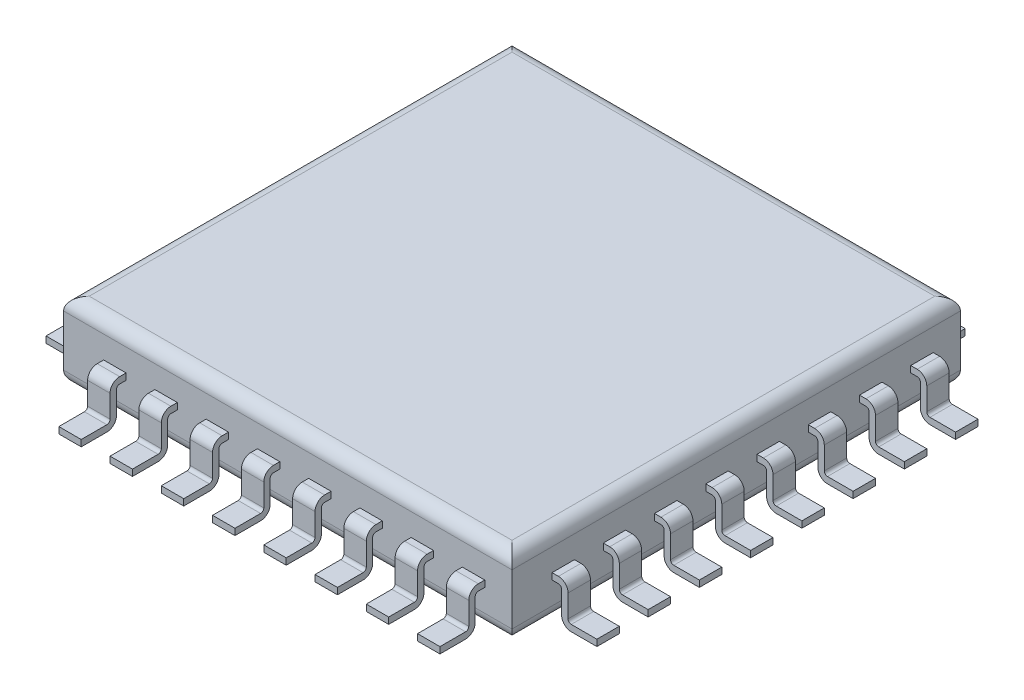
from build123d import *

# Parameters (mm, degrees)
SKETCH1_W                    = 7
SKETCH1_H                    = 7
BOSS_EXTRUDE1_DEPTH          = 1.2
FILLET1_R                    = 0.2
SKETCH3_W                    = 0.35
SKETCH3_H                    = 0.1
LPATTERN1_COUNT              = 8
LPATTERN1_PITCH              = 0.8
CIRPATTERN1_COPY_1_SKETCH_W  = 0.35
CIRPATTERN1_COPY_1_SKETCH_H  = 0.1
CIRPATTERN1_COPY_2_SKETCH_W  = 0.35
CIRPATTERN1_COPY_2_SKETCH_H  = 0.1
CIRPATTERN1_COPY_3_SKETCH_W  = 0.35
CIRPATTERN1_COPY_3_SKETCH_H  = 0.1
CIRPATTERN1_COPY_4_SKETCH_W  = 0.35
CIRPATTERN1_COPY_4_SKETCH_H  = 0.1
CIRPATTERN1_COPY_5_SKETCH_W  = 0.35
CIRPATTERN1_COPY_5_SKETCH_H  = 0.1
CIRPATTERN1_COPY_6_SKETCH_W  = 0.35
CIRPATTERN1_COPY_6_SKETCH_H  = 0.1
CIRPATTERN1_COPY_7_SKETCH_W  = 0.35
CIRPATTERN1_COPY_7_SKETCH_H  = 0.1
CIRPATTERN1_COPY_8_SKETCH_W  = 0.35
CIRPATTERN1_COPY_8_SKETCH_H  = 0.1
CIRPATTERN1_COPY_9_SKETCH_W  = 0.35
CIRPATTERN1_COPY_9_SKETCH_H  = 0.1
CIRPATTERN1_COPY_10_SKETCH_W = 0.35
CIRPATTERN1_COPY_10_SKETCH_H = 0.1
CIRPATTERN1_COPY_11_SKETCH_W = 0.35
CIRPATTERN1_COPY_11_SKETCH_H = 0.1
CIRPATTERN1_COPY_12_SKETCH_W = 0.35
CIRPATTERN1_COPY_12_SKETCH_H = 0.1
CIRPATTERN1_COPY_13_SKETCH_W = 0.35
CIRPATTERN1_COPY_13_SKETCH_H = 0.1
CIRPATTERN1_COPY_14_SKETCH_W = 0.35
CIRPATTERN1_COPY_14_SKETCH_H = 0.1
CIRPATTERN1_COPY_15_SKETCH_W = 0.35
CIRPATTERN1_COPY_15_SKETCH_H = 0.1
CIRPATTERN1_COPY_16_SKETCH_W = 0.35
CIRPATTERN1_COPY_16_SKETCH_H = 0.1
CIRPATTERN1_COPY_17_SKETCH_W = 0.35
CIRPATTERN1_COPY_17_SKETCH_H = 0.1
CIRPATTERN1_COPY_18_SKETCH_W = 0.35
CIRPATTERN1_COPY_18_SKETCH_H = 0.1
CIRPATTERN1_COPY_19_SKETCH_W = 0.35
CIRPATTERN1_COPY_19_SKETCH_H = 0.1
CIRPATTERN1_COPY_20_SKETCH_W = 0.35
CIRPATTERN1_COPY_20_SKETCH_H = 0.1
CIRPATTERN1_COPY_21_SKETCH_W = 0.35
CIRPATTERN1_COPY_21_SKETCH_H = 0.1
CIRPATTERN1_COPY_22_SKETCH_W = 0.35
CIRPATTERN1_COPY_22_SKETCH_H = 0.1
CIRPATTERN1_COPY_23_SKETCH_W = 0.35
CIRPATTERN1_COPY_23_SKETCH_H = 0.1
CIRPATTERN1_COPY_24_SKETCH_W = 0.35
CIRPATTERN1_COPY_24_SKETCH_H = 0.1


with BuildPart() as part:
    # Sketch1 → Boss-Extrude1 (new body)
    with BuildSketch(Plane(origin=(0, 0, 0), x_dir=(1, 0, 0), z_dir=(0, 1, 0))):
        Rectangle(SKETCH1_W, SKETCH1_H)
    extrude(amount=BOSS_EXTRUDE1_DEPTH)

    # Fillet1
    fillet1_edges = [part.edges().sort_by_distance(p)[0] for p in [
        (0, 0, -3.5),
        (-3.5, 0, 0),
        (0, 0, 3.5),
        (3.5, 0, 0),
        (0, 1.2, -3.5),
        (3.5, 1.2, 0),
        (0, 1.2, 3.5),
        (-3.5, 1.2, 0),
    ]]
    fillet(fillet1_edges, radius=FILLET1_R)

    # Sweep1: sweep along a path in Sketch2
    with BuildLine(Plane(origin=(0, 0, -2.7), x_dir=(-1, 0, 0), z_dir=(0, 0, -1))) as sweep1_path:
        Line((3.5, 0.6), (3.6, 0.6))
        ThreePointArc((3.6, 0.6), (3.670710678, 0.570710678), (3.7, 0.5))
        Line((3.7, 0.5), (3.7, 0.15))
        ThreePointArc((3.7, 0.15), (3.729289322, 0.079289322), (3.8, 0.05))
        Line((3.8, 0.05), (4.2, 0.05))
    # Sketch3 → Sweep1 (sweep)
    with BuildSketch(Plane.ZY.offset(3.5)):
        with Locations((-2.7, 0.6)):
            Rectangle(SKETCH3_W, SKETCH3_H)
    sweep1 = sweep(path=sweep1_path.line)

    # LPattern1: Sweep1 ×8
    with Locations(*[(0, 0, i * LPATTERN1_PITCH) for i in range(1, LPATTERN1_COUNT)]):
        add(sweep1)

    # CirPattern1 copy 1: sweep along a path in CirPattern1 copy 1 path
    with BuildLine(Plane(origin=(1.9, 0, 0), x_dir=(0, 0, -1), z_dir=(1, 0, 0))) as cirpattern1_copy_1_path:
        Line((3.5, 0.6), (3.6, 0.6))
        ThreePointArc((3.6, 0.6), (3.670710678, 0.570710678), (3.7, 0.5))
        Line((3.7, 0.5), (3.7, 0.15))
        ThreePointArc((3.7, 0.15), (3.729289322, 0.079289322), (3.8, 0.05))
        Line((3.8, 0.05), (4.2, 0.05))
    # CirPattern1 copy 1 sketch → CirPattern1 copy 1 (sweep)
    with BuildSketch(Plane(origin=(-0.8, 0, -3.5), x_dir=(-1, 0, 0), z_dir=(0, 0, -1))):
        with Locations((-2.7, 0.6)):
            Rectangle(CIRPATTERN1_COPY_1_SKETCH_W, CIRPATTERN1_COPY_1_SKETCH_H)
    sweep(path=cirpattern1_copy_1_path.line)

    # CirPattern1 copy 2: sweep along a path in CirPattern1 copy 2 path
    with BuildLine(Plane.XY.offset(1.9)) as cirpattern1_copy_2_path:
        Line((3.5, 0.6), (3.6, 0.6))
        ThreePointArc((3.6, 0.6), (3.670710678, 0.570710678), (3.7, 0.5))
        Line((3.7, 0.5), (3.7, 0.15))
        ThreePointArc((3.7, 0.15), (3.729289322, 0.079289322), (3.8, 0.05))
        Line((3.8, 0.05), (4.2, 0.05))
    # CirPattern1 copy 2 sketch → CirPattern1 copy 2 (sweep)
    with BuildSketch(Plane(origin=(3.5, 0, -0.8), x_dir=(0, 0, -1), z_dir=(1, 0, 0))):
        with Locations((-2.7, 0.6)):
            Rectangle(CIRPATTERN1_COPY_2_SKETCH_W, CIRPATTERN1_COPY_2_SKETCH_H)
    sweep(path=cirpattern1_copy_2_path.line)

    # CirPattern1 copy 3: sweep along a path in CirPattern1 copy 3 path
    with BuildLine(Plane.ZY.offset(1.9)) as cirpattern1_copy_3_path:
        Line((3.5, 0.6), (3.6, 0.6))
        ThreePointArc((3.6, 0.6), (3.670710678, 0.570710678), (3.7, 0.5))
        Line((3.7, 0.5), (3.7, 0.15))
        ThreePointArc((3.7, 0.15), (3.729289322, 0.079289322), (3.8, 0.05))
        Line((3.8, 0.05), (4.2, 0.05))
    # CirPattern1 copy 3 sketch → CirPattern1 copy 3 (sweep)
    with BuildSketch(Plane(origin=(0.8, 0, 3.5), x_dir=(1, 0, 0), z_dir=(0, 0, 1))):
        with Locations((-2.7, 0.6)):
            Rectangle(CIRPATTERN1_COPY_3_SKETCH_W, CIRPATTERN1_COPY_3_SKETCH_H)
    sweep(path=cirpattern1_copy_3_path.line)

    # CirPattern1 copy 4: sweep along a path in CirPattern1 copy 4 path
    with BuildLine(Plane(origin=(1.1, 0, 0), x_dir=(0, 0, -1), z_dir=(1, 0, 0))) as cirpattern1_copy_4_path:
        Line((3.5, 0.6), (3.6, 0.6))
        ThreePointArc((3.6, 0.6), (3.670710678, 0.570710678), (3.7, 0.5))
        Line((3.7, 0.5), (3.7, 0.15))
        ThreePointArc((3.7, 0.15), (3.729289322, 0.079289322), (3.8, 0.05))
        Line((3.8, 0.05), (4.2, 0.05))
    # CirPattern1 copy 4 sketch → CirPattern1 copy 4 (sweep)
    with BuildSketch(Plane(origin=(-1.6, 0, -3.5), x_dir=(-1, 0, 0), z_dir=(0, 0, -1))):
        with Locations((-2.7, 0.6)):
            Rectangle(CIRPATTERN1_COPY_4_SKETCH_W, CIRPATTERN1_COPY_4_SKETCH_H)
    sweep(path=cirpattern1_copy_4_path.line)

    # CirPattern1 copy 5: sweep along a path in CirPattern1 copy 5 path
    with BuildLine(Plane.XY.offset(1.1)) as cirpattern1_copy_5_path:
        Line((3.5, 0.6), (3.6, 0.6))
        ThreePointArc((3.6, 0.6), (3.670710678, 0.570710678), (3.7, 0.5))
        Line((3.7, 0.5), (3.7, 0.15))
        ThreePointArc((3.7, 0.15), (3.729289322, 0.079289322), (3.8, 0.05))
        Line((3.8, 0.05), (4.2, 0.05))
    # CirPattern1 copy 5 sketch → CirPattern1 copy 5 (sweep)
    with BuildSketch(Plane(origin=(3.5, 0, -1.6), x_dir=(0, 0, -1), z_dir=(1, 0, 0))):
        with Locations((-2.7, 0.6)):
            Rectangle(CIRPATTERN1_COPY_5_SKETCH_W, CIRPATTERN1_COPY_5_SKETCH_H)
    sweep(path=cirpattern1_copy_5_path.line)

    # CirPattern1 copy 6: sweep along a path in CirPattern1 copy 6 path
    with BuildLine(Plane.ZY.offset(1.1)) as cirpattern1_copy_6_path:
        Line((3.5, 0.6), (3.6, 0.6))
        ThreePointArc((3.6, 0.6), (3.670710678, 0.570710678), (3.7, 0.5))
        Line((3.7, 0.5), (3.7, 0.15))
        ThreePointArc((3.7, 0.15), (3.729289322, 0.079289322), (3.8, 0.05))
        Line((3.8, 0.05), (4.2, 0.05))
    # CirPattern1 copy 6 sketch → CirPattern1 copy 6 (sweep)
    with BuildSketch(Plane(origin=(1.6, 0, 3.5), x_dir=(1, 0, 0), z_dir=(0, 0, 1))):
        with Locations((-2.7, 0.6)):
            Rectangle(CIRPATTERN1_COPY_6_SKETCH_W, CIRPATTERN1_COPY_6_SKETCH_H)
    sweep(path=cirpattern1_copy_6_path.line)

    # CirPattern1 copy 7: sweep along a path in CirPattern1 copy 7 path
    with BuildLine(Plane(origin=(0.3, 0, 0), x_dir=(0, 0, -1), z_dir=(1, 0, 0))) as cirpattern1_copy_7_path:
        Line((3.5, 0.6), (3.6, 0.6))
        ThreePointArc((3.6, 0.6), (3.670710678, 0.570710678), (3.7, 0.5))
        Line((3.7, 0.5), (3.7, 0.15))
        ThreePointArc((3.7, 0.15), (3.729289322, 0.079289322), (3.8, 0.05))
        Line((3.8, 0.05), (4.2, 0.05))
    # CirPattern1 copy 7 sketch → CirPattern1 copy 7 (sweep)
    with BuildSketch(Plane(origin=(-2.4, 0, -3.5), x_dir=(-1, 0, 0), z_dir=(0, 0, -1))):
        with Locations((-2.7, 0.6)):
            Rectangle(CIRPATTERN1_COPY_7_SKETCH_W, CIRPATTERN1_COPY_7_SKETCH_H)
    sweep(path=cirpattern1_copy_7_path.line)

    # CirPattern1 copy 8: sweep along a path in CirPattern1 copy 8 path
    with BuildLine(Plane.XY.offset(0.3)) as cirpattern1_copy_8_path:
        Line((3.5, 0.6), (3.6, 0.6))
        ThreePointArc((3.6, 0.6), (3.670710678, 0.570710678), (3.7, 0.5))
        Line((3.7, 0.5), (3.7, 0.15))
        ThreePointArc((3.7, 0.15), (3.729289322, 0.079289322), (3.8, 0.05))
        Line((3.8, 0.05), (4.2, 0.05))
    # CirPattern1 copy 8 sketch → CirPattern1 copy 8 (sweep)
    with BuildSketch(Plane(origin=(3.5, 0, -2.4), x_dir=(0, 0, -1), z_dir=(1, 0, 0))):
        with Locations((-2.7, 0.6)):
            Rectangle(CIRPATTERN1_COPY_8_SKETCH_W, CIRPATTERN1_COPY_8_SKETCH_H)
    sweep(path=cirpattern1_copy_8_path.line)

    # CirPattern1 copy 9: sweep along a path in CirPattern1 copy 9 path
    with BuildLine(Plane.ZY.offset(0.3)) as cirpattern1_copy_9_path:
        Line((3.5, 0.6), (3.6, 0.6))
        ThreePointArc((3.6, 0.6), (3.670710678, 0.570710678), (3.7, 0.5))
        Line((3.7, 0.5), (3.7, 0.15))
        ThreePointArc((3.7, 0.15), (3.729289322, 0.079289322), (3.8, 0.05))
        Line((3.8, 0.05), (4.2, 0.05))
    # CirPattern1 copy 9 sketch → CirPattern1 copy 9 (sweep)
    with BuildSketch(Plane(origin=(2.4, 0, 3.5), x_dir=(1, 0, 0), z_dir=(0, 0, 1))):
        with Locations((-2.7, 0.6)):
            Rectangle(CIRPATTERN1_COPY_9_SKETCH_W, CIRPATTERN1_COPY_9_SKETCH_H)
    sweep(path=cirpattern1_copy_9_path.line)

    # CirPattern1 copy 10: sweep along a path in CirPattern1 copy 10 path
    with BuildLine(Plane(origin=(-0.5, 0, 0), x_dir=(0, 0, -1), z_dir=(1, 0, 0))) as cirpattern1_copy_10_path:
        Line((3.5, 0.6), (3.6, 0.6))
        ThreePointArc((3.6, 0.6), (3.670710678, 0.570710678), (3.7, 0.5))
        Line((3.7, 0.5), (3.7, 0.15))
        ThreePointArc((3.7, 0.15), (3.729289322, 0.079289322), (3.8, 0.05))
        Line((3.8, 0.05), (4.2, 0.05))
    # CirPattern1 copy 10 sketch → CirPattern1 copy 10 (sweep)
    with BuildSketch(Plane(origin=(-3.2, 0, -3.5), x_dir=(-1, 0, 0), z_dir=(0, 0, -1))):
        with Locations((-2.7, 0.6)):
            Rectangle(CIRPATTERN1_COPY_10_SKETCH_W, CIRPATTERN1_COPY_10_SKETCH_H)
    sweep(path=cirpattern1_copy_10_path.line)

    # CirPattern1 copy 11: sweep along a path in CirPattern1 copy 11 path
    with BuildLine(Plane.XY.offset(-0.5)) as cirpattern1_copy_11_path:
        Line((3.5, 0.6), (3.6, 0.6))
        ThreePointArc((3.6, 0.6), (3.670710678, 0.570710678), (3.7, 0.5))
        Line((3.7, 0.5), (3.7, 0.15))
        ThreePointArc((3.7, 0.15), (3.729289322, 0.079289322), (3.8, 0.05))
        Line((3.8, 0.05), (4.2, 0.05))
    # CirPattern1 copy 11 sketch → CirPattern1 copy 11 (sweep)
    with BuildSketch(Plane(origin=(3.5, 0, -3.2), x_dir=(0, 0, -1), z_dir=(1, 0, 0))):
        with Locations((-2.7, 0.6)):
            Rectangle(CIRPATTERN1_COPY_11_SKETCH_W, CIRPATTERN1_COPY_11_SKETCH_H)
    sweep(path=cirpattern1_copy_11_path.line)

    # CirPattern1 copy 12: sweep along a path in CirPattern1 copy 12 path
    with BuildLine(Plane.ZY.offset(-0.5)) as cirpattern1_copy_12_path:
        Line((3.5, 0.6), (3.6, 0.6))
        ThreePointArc((3.6, 0.6), (3.670710678, 0.570710678), (3.7, 0.5))
        Line((3.7, 0.5), (3.7, 0.15))
        ThreePointArc((3.7, 0.15), (3.729289322, 0.079289322), (3.8, 0.05))
        Line((3.8, 0.05), (4.2, 0.05))
    # CirPattern1 copy 12 sketch → CirPattern1 copy 12 (sweep)
    with BuildSketch(Plane(origin=(3.2, 0, 3.5), x_dir=(1, 0, 0), z_dir=(0, 0, 1))):
        with Locations((-2.7, 0.6)):
            Rectangle(CIRPATTERN1_COPY_12_SKETCH_W, CIRPATTERN1_COPY_12_SKETCH_H)
    sweep(path=cirpattern1_copy_12_path.line)

    # CirPattern1 copy 13: sweep along a path in CirPattern1 copy 13 path
    with BuildLine(Plane(origin=(-1.3, 0, 0), x_dir=(0, 0, -1), z_dir=(1, 0, 0))) as cirpattern1_copy_13_path:
        Line((3.5, 0.6), (3.6, 0.6))
        ThreePointArc((3.6, 0.6), (3.670710678, 0.570710678), (3.7, 0.5))
        Line((3.7, 0.5), (3.7, 0.15))
        ThreePointArc((3.7, 0.15), (3.729289322, 0.079289322), (3.8, 0.05))
        Line((3.8, 0.05), (4.2, 0.05))
    # CirPattern1 copy 13 sketch → CirPattern1 copy 13 (sweep)
    with BuildSketch(Plane(origin=(-4, 0, -3.5), x_dir=(-1, 0, 0), z_dir=(0, 0, -1))):
        with Locations((-2.7, 0.6)):
            Rectangle(CIRPATTERN1_COPY_13_SKETCH_W, CIRPATTERN1_COPY_13_SKETCH_H)
    sweep(path=cirpattern1_copy_13_path.line)

    # CirPattern1 copy 14: sweep along a path in CirPattern1 copy 14 path
    with BuildLine(Plane.XY.offset(-1.3)) as cirpattern1_copy_14_path:
        Line((3.5, 0.6), (3.6, 0.6))
        ThreePointArc((3.6, 0.6), (3.670710678, 0.570710678), (3.7, 0.5))
        Line((3.7, 0.5), (3.7, 0.15))
        ThreePointArc((3.7, 0.15), (3.729289322, 0.079289322), (3.8, 0.05))
        Line((3.8, 0.05), (4.2, 0.05))
    # CirPattern1 copy 14 sketch → CirPattern1 copy 14 (sweep)
    with BuildSketch(Plane(origin=(3.5, 0, -4), x_dir=(0, 0, -1), z_dir=(1, 0, 0))):
        with Locations((-2.7, 0.6)):
            Rectangle(CIRPATTERN1_COPY_14_SKETCH_W, CIRPATTERN1_COPY_14_SKETCH_H)
    sweep(path=cirpattern1_copy_14_path.line)

    # CirPattern1 copy 15: sweep along a path in CirPattern1 copy 15 path
    with BuildLine(Plane.ZY.offset(-1.3)) as cirpattern1_copy_15_path:
        Line((3.5, 0.6), (3.6, 0.6))
        ThreePointArc((3.6, 0.6), (3.670710678, 0.570710678), (3.7, 0.5))
        Line((3.7, 0.5), (3.7, 0.15))
        ThreePointArc((3.7, 0.15), (3.729289322, 0.079289322), (3.8, 0.05))
        Line((3.8, 0.05), (4.2, 0.05))
    # CirPattern1 copy 15 sketch → CirPattern1 copy 15 (sweep)
    with BuildSketch(Plane(origin=(4, 0, 3.5), x_dir=(1, 0, 0), z_dir=(0, 0, 1))):
        with Locations((-2.7, 0.6)):
            Rectangle(CIRPATTERN1_COPY_15_SKETCH_W, CIRPATTERN1_COPY_15_SKETCH_H)
    sweep(path=cirpattern1_copy_15_path.line)

    # CirPattern1 copy 16: sweep along a path in CirPattern1 copy 16 path
    with BuildLine(Plane(origin=(-2.1, 0, 0), x_dir=(0, 0, -1), z_dir=(1, 0, 0))) as cirpattern1_copy_16_path:
        Line((3.5, 0.6), (3.6, 0.6))
        ThreePointArc((3.6, 0.6), (3.670710678, 0.570710678), (3.7, 0.5))
        Line((3.7, 0.5), (3.7, 0.15))
        ThreePointArc((3.7, 0.15), (3.729289322, 0.079289322), (3.8, 0.05))
        Line((3.8, 0.05), (4.2, 0.05))
    # CirPattern1 copy 16 sketch → CirPattern1 copy 16 (sweep)
    with BuildSketch(Plane(origin=(-4.8, 0, -3.5), x_dir=(-1, 0, 0), z_dir=(0, 0, -1))):
        with Locations((-2.7, 0.6)):
            Rectangle(CIRPATTERN1_COPY_16_SKETCH_W, CIRPATTERN1_COPY_16_SKETCH_H)
    sweep(path=cirpattern1_copy_16_path.line)

    # CirPattern1 copy 17: sweep along a path in CirPattern1 copy 17 path
    with BuildLine(Plane.XY.offset(-2.1)) as cirpattern1_copy_17_path:
        Line((3.5, 0.6), (3.6, 0.6))
        ThreePointArc((3.6, 0.6), (3.670710678, 0.570710678), (3.7, 0.5))
        Line((3.7, 0.5), (3.7, 0.15))
        ThreePointArc((3.7, 0.15), (3.729289322, 0.079289322), (3.8, 0.05))
        Line((3.8, 0.05), (4.2, 0.05))
    # CirPattern1 copy 17 sketch → CirPattern1 copy 17 (sweep)
    with BuildSketch(Plane(origin=(3.5, 0, -4.8), x_dir=(0, 0, -1), z_dir=(1, 0, 0))):
        with Locations((-2.7, 0.6)):
            Rectangle(CIRPATTERN1_COPY_17_SKETCH_W, CIRPATTERN1_COPY_17_SKETCH_H)
    sweep(path=cirpattern1_copy_17_path.line)

    # CirPattern1 copy 18: sweep along a path in CirPattern1 copy 18 path
    with BuildLine(Plane.ZY.offset(-2.1)) as cirpattern1_copy_18_path:
        Line((3.5, 0.6), (3.6, 0.6))
        ThreePointArc((3.6, 0.6), (3.670710678, 0.570710678), (3.7, 0.5))
        Line((3.7, 0.5), (3.7, 0.15))
        ThreePointArc((3.7, 0.15), (3.729289322, 0.079289322), (3.8, 0.05))
        Line((3.8, 0.05), (4.2, 0.05))
    # CirPattern1 copy 18 sketch → CirPattern1 copy 18 (sweep)
    with BuildSketch(Plane(origin=(4.8, 0, 3.5), x_dir=(1, 0, 0), z_dir=(0, 0, 1))):
        with Locations((-2.7, 0.6)):
            Rectangle(CIRPATTERN1_COPY_18_SKETCH_W, CIRPATTERN1_COPY_18_SKETCH_H)
    sweep(path=cirpattern1_copy_18_path.line)

    # CirPattern1 copy 19: sweep along a path in CirPattern1 copy 19 path
    with BuildLine(Plane(origin=(-2.9, 0, 0), x_dir=(0, 0, -1), z_dir=(1, 0, 0))) as cirpattern1_copy_19_path:
        Line((3.5, 0.6), (3.6, 0.6))
        ThreePointArc((3.6, 0.6), (3.670710678, 0.570710678), (3.7, 0.5))
        Line((3.7, 0.5), (3.7, 0.15))
        ThreePointArc((3.7, 0.15), (3.729289322, 0.079289322), (3.8, 0.05))
        Line((3.8, 0.05), (4.2, 0.05))
    # CirPattern1 copy 19 sketch → CirPattern1 copy 19 (sweep)
    with BuildSketch(Plane(origin=(-5.6, 0, -3.5), x_dir=(-1, 0, 0), z_dir=(0, 0, -1))):
        with Locations((-2.7, 0.6)):
            Rectangle(CIRPATTERN1_COPY_19_SKETCH_W, CIRPATTERN1_COPY_19_SKETCH_H)
    sweep(path=cirpattern1_copy_19_path.line)

    # CirPattern1 copy 20: sweep along a path in CirPattern1 copy 20 path
    with BuildLine(Plane.XY.offset(-2.9)) as cirpattern1_copy_20_path:
        Line((3.5, 0.6), (3.6, 0.6))
        ThreePointArc((3.6, 0.6), (3.670710678, 0.570710678), (3.7, 0.5))
        Line((3.7, 0.5), (3.7, 0.15))
        ThreePointArc((3.7, 0.15), (3.729289322, 0.079289322), (3.8, 0.05))
        Line((3.8, 0.05), (4.2, 0.05))
    # CirPattern1 copy 20 sketch → CirPattern1 copy 20 (sweep)
    with BuildSketch(Plane(origin=(3.5, 0, -5.6), x_dir=(0, 0, -1), z_dir=(1, 0, 0))):
        with Locations((-2.7, 0.6)):
            Rectangle(CIRPATTERN1_COPY_20_SKETCH_W, CIRPATTERN1_COPY_20_SKETCH_H)
    sweep(path=cirpattern1_copy_20_path.line)

    # CirPattern1 copy 21: sweep along a path in CirPattern1 copy 21 path
    with BuildLine(Plane.ZY.offset(-2.9)) as cirpattern1_copy_21_path:
        Line((3.5, 0.6), (3.6, 0.6))
        ThreePointArc((3.6, 0.6), (3.670710678, 0.570710678), (3.7, 0.5))
        Line((3.7, 0.5), (3.7, 0.15))
        ThreePointArc((3.7, 0.15), (3.729289322, 0.079289322), (3.8, 0.05))
        Line((3.8, 0.05), (4.2, 0.05))
    # CirPattern1 copy 21 sketch → CirPattern1 copy 21 (sweep)
    with BuildSketch(Plane(origin=(5.6, 0, 3.5), x_dir=(1, 0, 0), z_dir=(0, 0, 1))):
        with Locations((-2.7, 0.6)):
            Rectangle(CIRPATTERN1_COPY_21_SKETCH_W, CIRPATTERN1_COPY_21_SKETCH_H)
    sweep(path=cirpattern1_copy_21_path.line)

    # CirPattern1 copy 22: sweep along a path in CirPattern1 copy 22 path
    with BuildLine(Plane(origin=(2.7, 0, 0), x_dir=(0, 0, -1), z_dir=(1, 0, 0))) as cirpattern1_copy_22_path:
        Line((3.5, 0.6), (3.6, 0.6))
        ThreePointArc((3.6, 0.6), (3.670710678, 0.570710678), (3.7, 0.5))
        Line((3.7, 0.5), (3.7, 0.15))
        ThreePointArc((3.7, 0.15), (3.729289322, 0.079289322), (3.8, 0.05))
        Line((3.8, 0.05), (4.2, 0.05))
    # CirPattern1 copy 22 sketch → CirPattern1 copy 22 (sweep)
    with BuildSketch(Plane(origin=(0, 0, -3.5), x_dir=(-1, 0, 0), z_dir=(0, 0, -1))):
        with Locations((-2.7, 0.6)):
            Rectangle(CIRPATTERN1_COPY_22_SKETCH_W, CIRPATTERN1_COPY_22_SKETCH_H)
    sweep(path=cirpattern1_copy_22_path.line)

    # CirPattern1 copy 23: sweep along a path in CirPattern1 copy 23 path
    with BuildLine(Plane.XY.offset(2.7)) as cirpattern1_copy_23_path:
        Line((3.5, 0.6), (3.6, 0.6))
        ThreePointArc((3.6, 0.6), (3.670710678, 0.570710678), (3.7, 0.5))
        Line((3.7, 0.5), (3.7, 0.15))
        ThreePointArc((3.7, 0.15), (3.729289322, 0.079289322), (3.8, 0.05))
        Line((3.8, 0.05), (4.2, 0.05))
    # CirPattern1 copy 23 sketch → CirPattern1 copy 23 (sweep)
    with BuildSketch(Plane(origin=(3.5, 0, 0), x_dir=(0, 0, -1), z_dir=(1, 0, 0))):
        with Locations((-2.7, 0.6)):
            Rectangle(CIRPATTERN1_COPY_23_SKETCH_W, CIRPATTERN1_COPY_23_SKETCH_H)
    sweep(path=cirpattern1_copy_23_path.line)

    # CirPattern1 copy 24: sweep along a path in CirPattern1 copy 24 path
    with BuildLine(Plane.ZY.offset(2.7)) as cirpattern1_copy_24_path:
        Line((3.5, 0.6), (3.6, 0.6))
        ThreePointArc((3.6, 0.6), (3.670710678, 0.570710678), (3.7, 0.5))
        Line((3.7, 0.5), (3.7, 0.15))
        ThreePointArc((3.7, 0.15), (3.729289322, 0.079289322), (3.8, 0.05))
        Line((3.8, 0.05), (4.2, 0.05))
    # CirPattern1 copy 24 sketch → CirPattern1 copy 24 (sweep)
    with BuildSketch(Plane.XY.offset(3.5)):
        with Locations((-2.7, 0.6)):
            Rectangle(CIRPATTERN1_COPY_24_SKETCH_W, CIRPATTERN1_COPY_24_SKETCH_H)
    sweep(path=cirpattern1_copy_24_path.line)


solid = part.part
